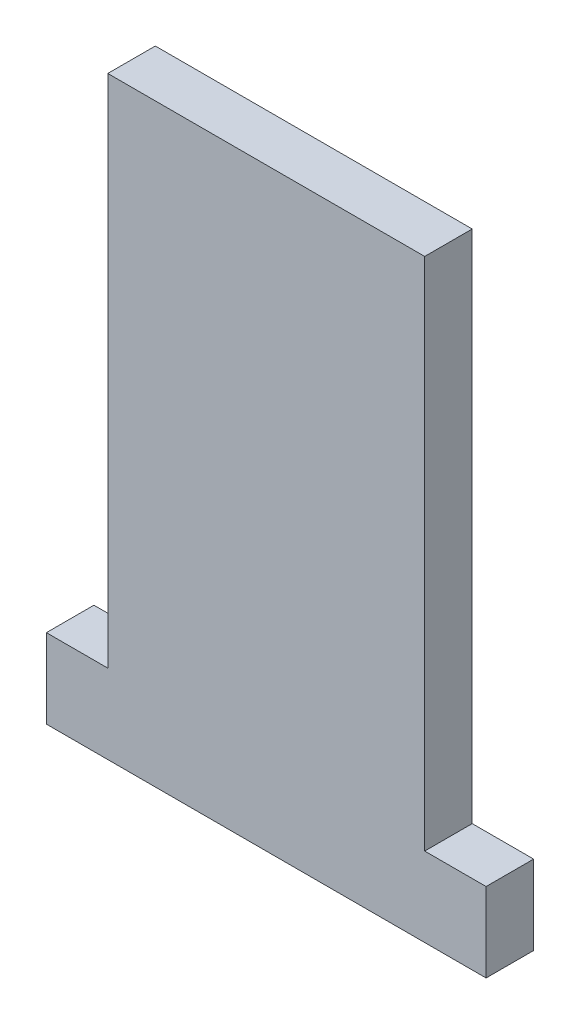
from build123d import *

# Parameters (mm, degrees)
SKETCH1_W           = 8
SKETCH1_H           = 13
BOSS_EXTRUDE1_DEPTH = 0.6
SKETCH2_W           = 11.1
SKETCH2_H           = 2
BOSS_EXTRUDE2_DEPTH = 1.2


with BuildPart() as part:
    # Sketch1 → Boss-Extrude1 (new, symmetric)
    with BuildSketch(Plane.XY):
        Rectangle(SKETCH1_W, SKETCH1_H)
    extrude(amount=BOSS_EXTRUDE1_DEPTH, both=True)

    # Sketch2 → Boss-Extrude2 (add)
    with BuildSketch(Plane.XY.offset(0.6)):
        with Locations((0, -7.5)):
            Rectangle(SKETCH2_W, SKETCH2_H)
    extrude(amount=-BOSS_EXTRUDE2_DEPTH)


solid = part.part
